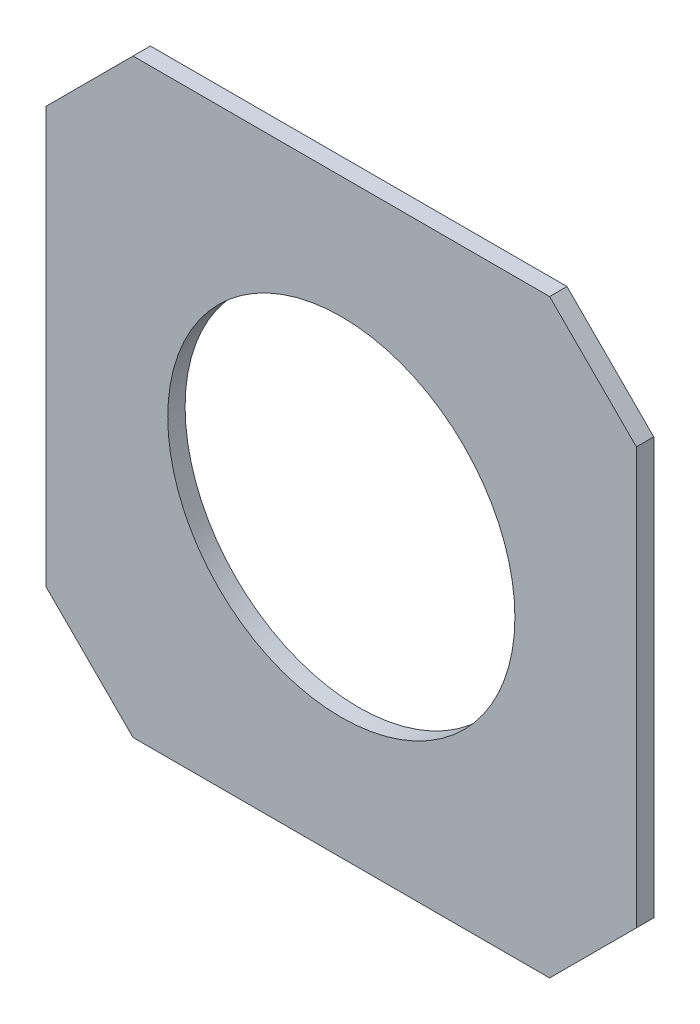
from build123d import *

# Parameters (mm, degrees)
SKETCH3_W           = 17
SKETCH3_H           = 17
BOSS_EXTRUDE1_DEPTH = 0.5
SKETCH4_R           = 5
CUT_EXTRUDE1_DEPTH  = 25.046829313


with BuildPart() as part:
    # Sketch3 → Boss-Extrude1 (new body)
    with BuildSketch(Plane.XY):
        with Locations((8.5, -8.5)):
            Rectangle(SKETCH3_W, SKETCH3_H)
    extrude(amount=BOSS_EXTRUDE1_DEPTH)

    # Sketch4 → Cut-Extrude1 (cut, through all)
    with BuildSketch(Plane.XY.offset(0.5)):
        with Locations((8.5, -8.5)):
            Circle(SKETCH4_R)
        Polygon((17, 0), (14.5, 0), (17, -2.5), align=None)
        Polygon((0, -2.5), (2.5, 0), (0, 0), align=None)
        Polygon((2.5, -17), (0, -14.5), (0, -17), align=None)
        Polygon((17, -17), (17, -14.5), (14.5, -17), align=None)
    extrude(amount=-CUT_EXTRUDE1_DEPTH, mode=Mode.SUBTRACT)


solid = part.part
